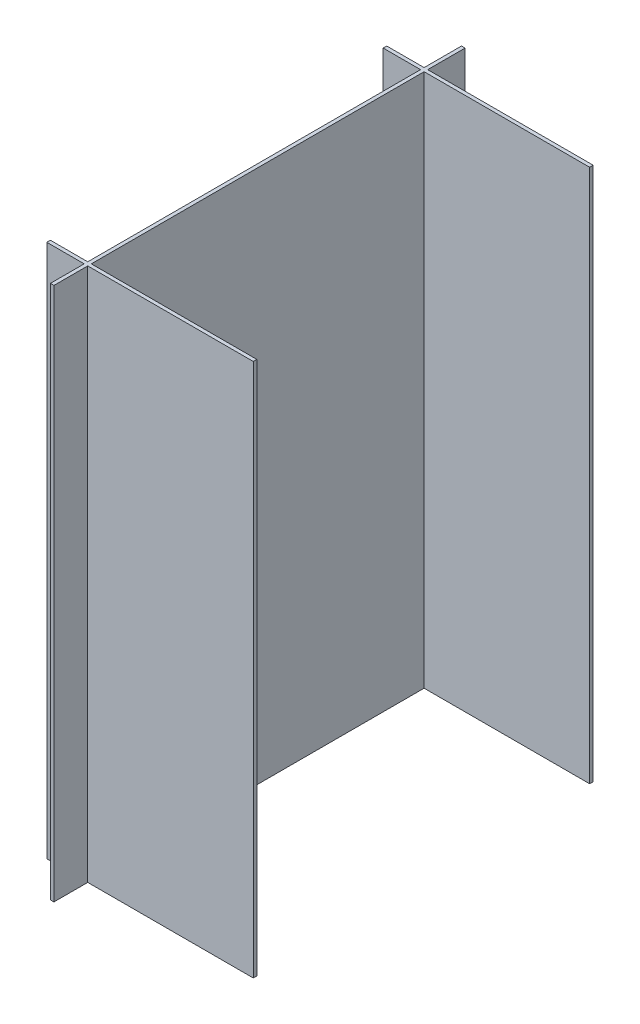
from build123d import *

# Parameters (mm, degrees)
BOSS_EXTRUDE1_DEPTH = 300


with BuildPart() as part:
    # Sketch1 → Boss-Extrude1 (new body)
    with BuildSketch(Plane(origin=(0, 0, 0), x_dir=(1, 0, 0), z_dir=(0, 1, 0))):
        Polygon((-56.161611152, -42.302266887), (-35.161611152, -42.302266887), (-35.161611152, -21.302266887), (-33.161611152, -21.302266887), (-33.161611152, -42.302266887), (59.838388848, -42.302266887), (59.838388848, -44.302266887), (-33.161611152, -44.302266887), (-33.161611152, -231.302266887), (59.838388848, -231.302266887), (59.838388848, -233.302266887), (-33.161611152, -233.302266887), (-33.161611152, -252.302266887), (-35.161611152, -252.302266887), (-35.161611152, -233.302266887), (-56.161611152, -233.302266887), (-56.161611152, -231.302266887), (-35.161611152, -231.302266887), (-35.161611152, -44.302266887), (-56.161611152, -44.302266887), align=None)
    extrude(amount=BOSS_EXTRUDE1_DEPTH)


solid = part.part
